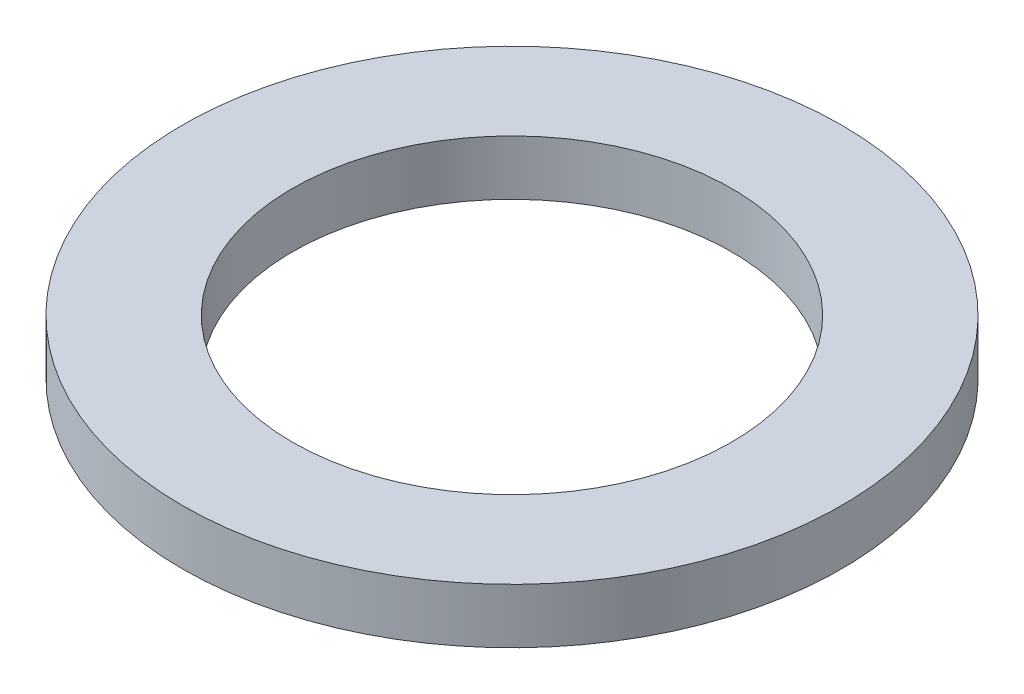
from build123d import *

# Parameters (mm, degrees)
SKETCH_1_R      = 30
SKETCH_1_R_2    = 20
EXTRUDE_1_DEPTH = 5


with BuildPart() as part:
    # 草图1 → 凸台-拉伸1 (new body)
    with BuildSketch(Plane(origin=(0, 0, 0), x_dir=(1, 0, 0), z_dir=(0, 1, 0))):
        with Locations(Location((0, 0, 0), (0, 0, 270))):
            Circle(SKETCH_1_R)
        with Locations(Location((0, 0, 0), (0, 0, 270))):
            Circle(SKETCH_1_R_2, mode=Mode.SUBTRACT)
    extrude(amount=EXTRUDE_1_DEPTH)


solid = part.part
